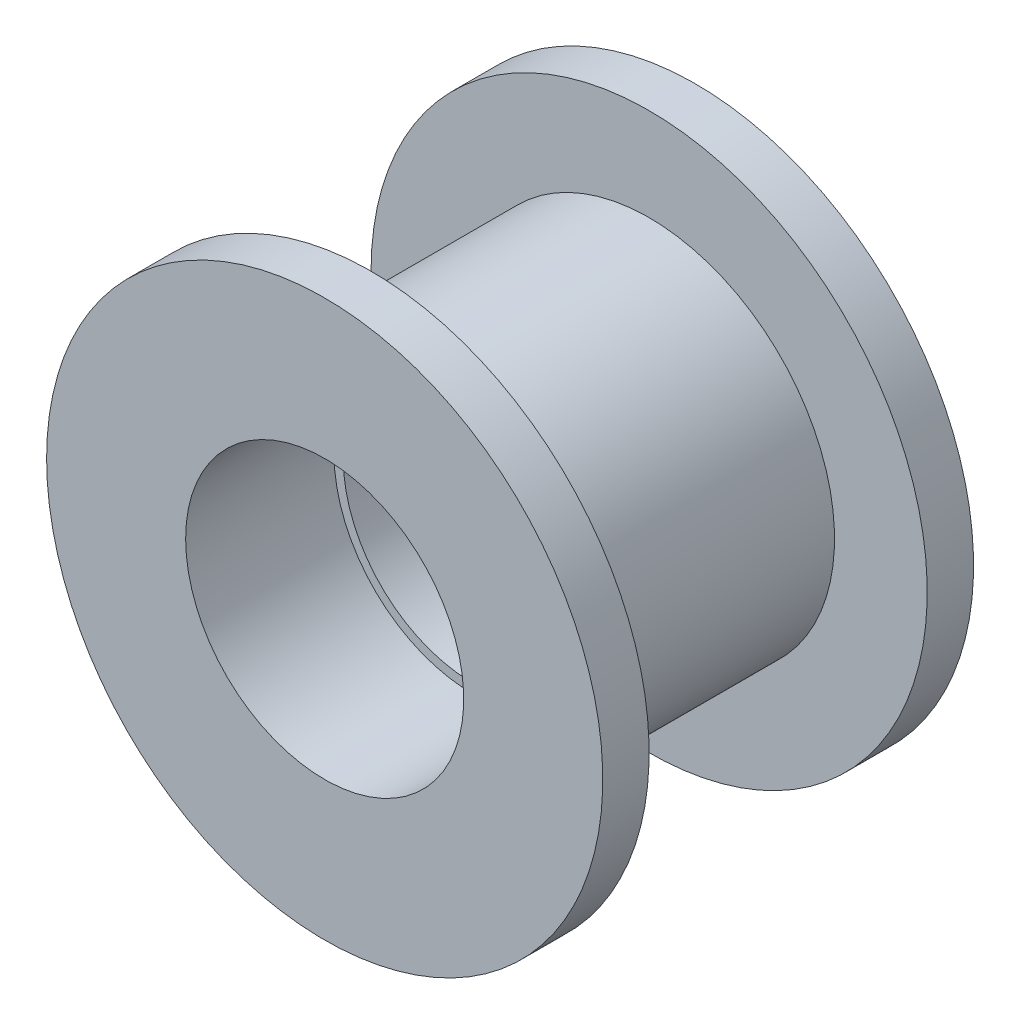
from build123d import *

# Parameters (mm, degrees)
CUT_EXTRUDE1_START = -16
CUT_EXTRUDE1_DEPTH = 16


with BuildPart() as part:
    # Sketch1 → Revolve1 (revolve)
    with BuildSketch(Plane(origin=(0, 0, 0), x_dir=(1, 0, 0), z_dir=(0, 1, 0)), mode=Mode.PRIVATE) as revolve1_sk:
        Polygon((15, 0), (30, 0), (30, 5), (20, 5), (20, 35), (30, 35), (30, 40), (14, 40), (14, 16), (15, 16), align=None)
    revolve(revolve1_sk.sketch.rotate(Axis((0, 0, -89.857142857), (0, 0, 1)), 180), axis=Axis((0, 0, -89.857142857), (0, 0, 1)))

    # Sketch2 → Cut-Extrude1 (cut)
    with BuildSketch(Plane(origin=(0, 0, -40), x_dir=(-1, 0, 0), z_dir=(0, 0, -1)).offset(CUT_EXTRUDE1_START)):
        with BuildLine():
            Line((4, 17.3), (-4, 17.3))
            Line((-4, 17.3), (-4, 13.416407865))
            ThreePointArc((-4, 13.416407865), (0, 14), (4, 13.416407865))
            Line((4, 13.416407865), (4, 17.3))
        make_face()
    extrude(amount=CUT_EXTRUDE1_DEPTH, mode=Mode.SUBTRACT)


solid = part.part
